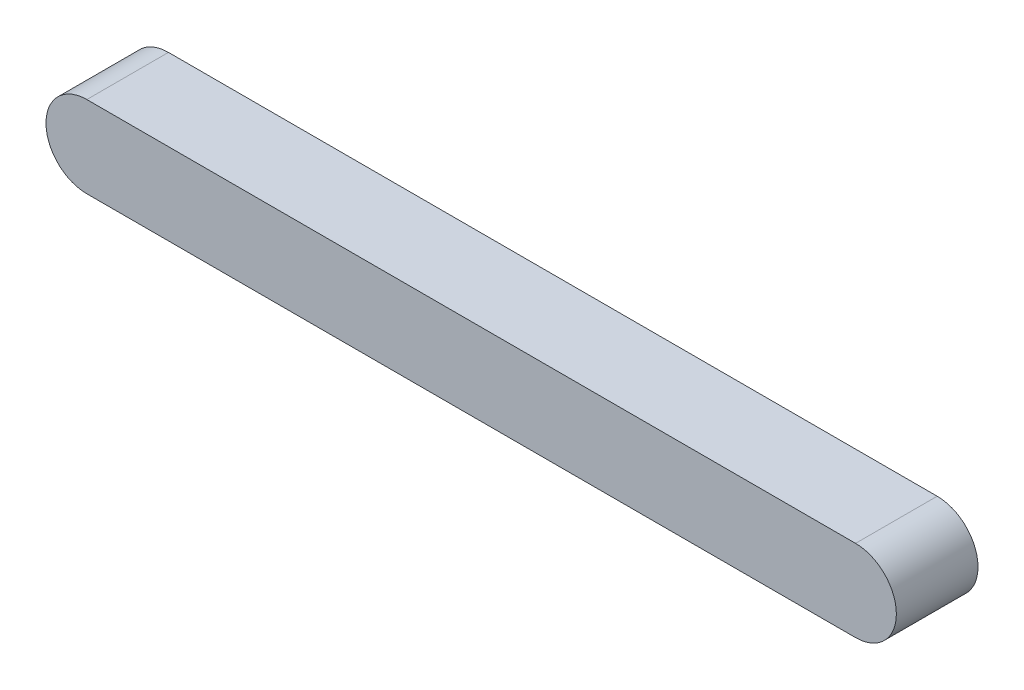
from build123d import *

# Parameters (mm, degrees)
BOSS_EXTRUDE1_DEPTH = 12


with BuildPart() as part:
    # Sketch1 → Boss-Extrude1 (new body)
    with BuildSketch(Plane.XY):
        with BuildLine():
            Line((-56.5, 6), (56.5, 6))
            ThreePointArc((56.5, 6), (62.5, 0), (56.5, -6))
            Line((56.5, -6), (-56.5, -6))
            ThreePointArc((-56.5, -6), (-62.5, 0), (-56.5, 6))
        make_face()
    extrude(amount=BOSS_EXTRUDE1_DEPTH)


solid = part.part
